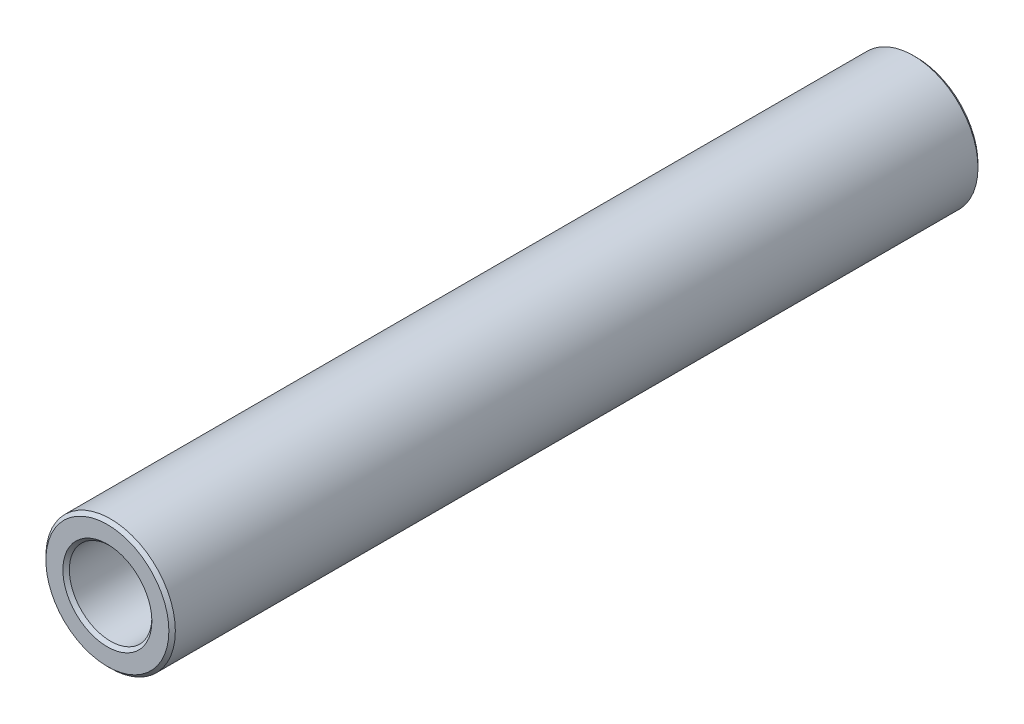
from build123d import *

# Parameters (mm, degrees)
SKETCH1_R           = 4
SKETCH1_R_2         = 2.55
BOSS_EXTRUDE1_DEPTH = 50
CHAMFER1_SIZE       = 0.2


with BuildPart() as part:
    # Sketch1 → Boss-Extrude1 (new body)
    with BuildSketch(Plane.XY):
        Circle(SKETCH1_R)
        Circle(SKETCH1_R_2, mode=Mode.SUBTRACT)
    extrude(amount=BOSS_EXTRUDE1_DEPTH)

    # Chamfer1
    chamfer1_edges = [part.edges().sort_by_distance(p)[0] for p in [
        (-4, 0, 0),
        (-4, 0, 50),
        (-2.55, 0, 0),
        (-2.55, 0, 50),
    ]]
    chamfer(chamfer1_edges, length=CHAMFER1_SIZE)


solid = part.part
